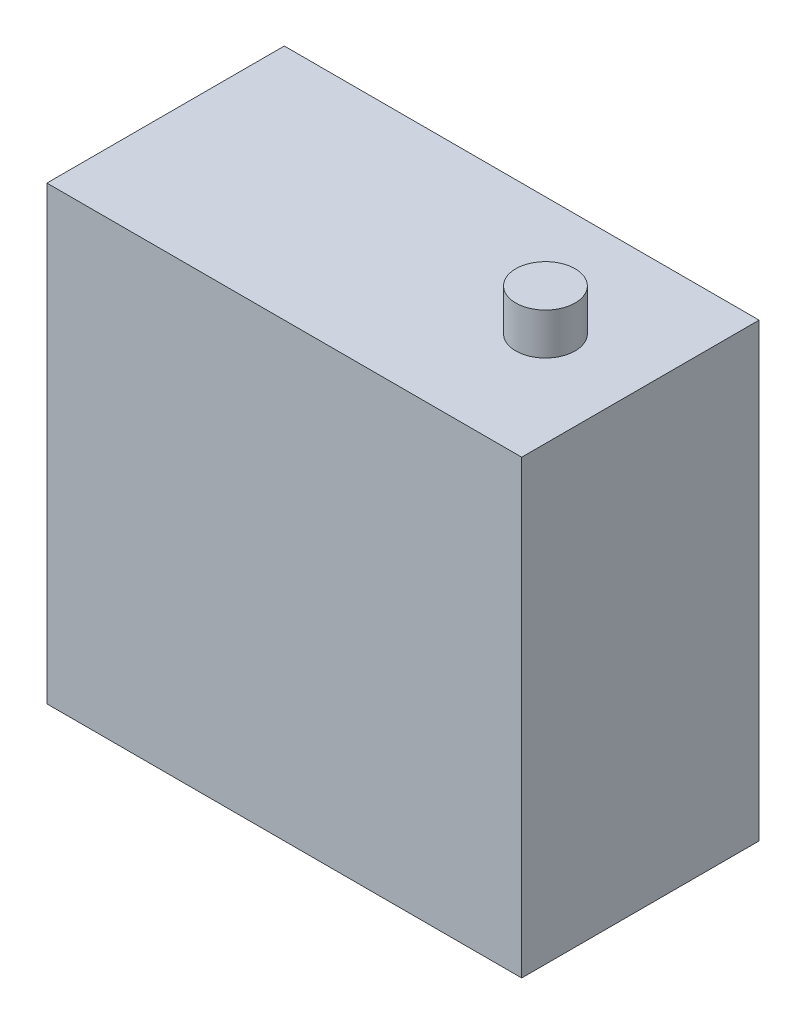
from build123d import *

# Parameters (mm, degrees)
SKETCH_1_W      = 40
SKETCH_1_H      = 20
EXTRUDE_1_DEPTH = 38
SKETCH_2_R      = 2.5
EXTRUDE_2_DEPTH = 3.5


with BuildPart() as part:
    # 草图1 → 凸台-拉伸1 (new body)
    with BuildSketch(Plane(origin=(0, 0, 0), x_dir=(1, 0, 0), z_dir=(0, 1, 0))):
        Rectangle(SKETCH_1_W, SKETCH_1_H)
    extrude(amount=EXTRUDE_1_DEPTH)

    # 草图2 → 凸台-拉伸2 (add)
    with BuildSketch(Plane(origin=(0, 38, 0), x_dir=(1, 0, 0), z_dir=(0, 1, 0))):
        with Locations(Location((12, 0, 0), (0, 0, 270))):
            Circle(SKETCH_2_R)
    extrude(amount=EXTRUDE_2_DEPTH)


solid = part.part
